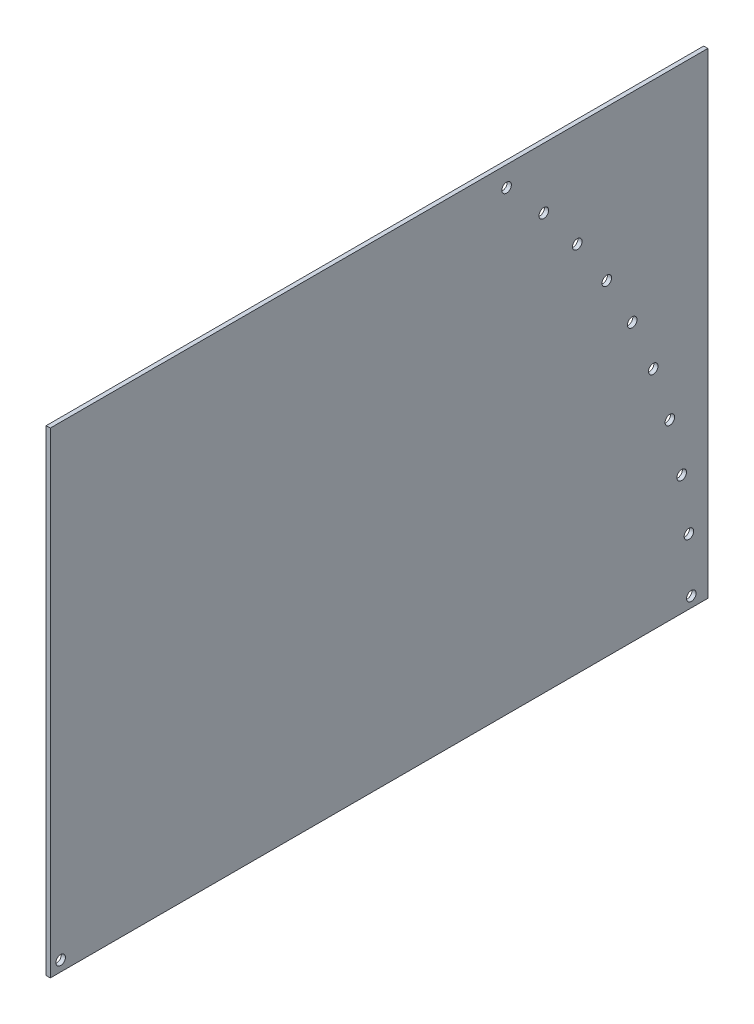
from build123d import *

# Parameters (mm, degrees)
SKETCH1_W           = 401.869209935
SKETCH1_H           = 291.062175581
SKETCH1_R           = 2.921
BOSS_EXTRUDE1_DEPTH = 2.54


with BuildPart() as part:
    # Sketch1 → Boss-Extrude1 (new body)
    with BuildSketch(Plane(origin=(0, 0, 0), x_dir=(0, 0, -1), z_dir=(1, 0, 0))):
        with Locations((200.934604968, 145.531087791)):
            Rectangle(SKETCH1_W, SKETCH1_H)
        with Locations((6.35, 6.35)):
            Circle(SKETCH1_R, mode=Mode.SUBTRACT)
        with Locations((391.7499912, 6.35)):
            Circle(SKETCH1_R, mode=Mode.SUBTRACT)
        with Locations((390.283427878, 39.939822488)):
            Circle(SKETCH1_R, mode=Mode.SUBTRACT)
        with Locations((385.894899345, 73.274006145)):
            Circle(SKETCH1_R, mode=Mode.SUBTRACT)
        with Locations((378.617804952, 106.098857705)):
            Circle(SKETCH1_R, mode=Mode.SUBTRACT)
        with Locations((368.507527782, 138.164560228)):
            Circle(SKETCH1_R, mode=Mode.SUBTRACT)
        with Locations((355.641013148, 169.227074356)):
            Circle(SKETCH1_R, mode=Mode.SUBTRACT)
        with Locations((340.116182997, 199.0499956)):
            Circle(SKETCH1_R, mode=Mode.SUBTRACT)
        with Locations((322.05119066, 227.406353522)):
            Circle(SKETCH1_R, mode=Mode.SUBTRACT)
        with Locations((301.583521637, 254.080339117)):
            Circle(SKETCH1_R, mode=Mode.SUBTRACT)
        with Locations((278.868947247, 278.868947247)):
            Circle(SKETCH1_R, mode=Mode.SUBTRACT)
    extrude(amount=BOSS_EXTRUDE1_DEPTH)


solid = part.part
